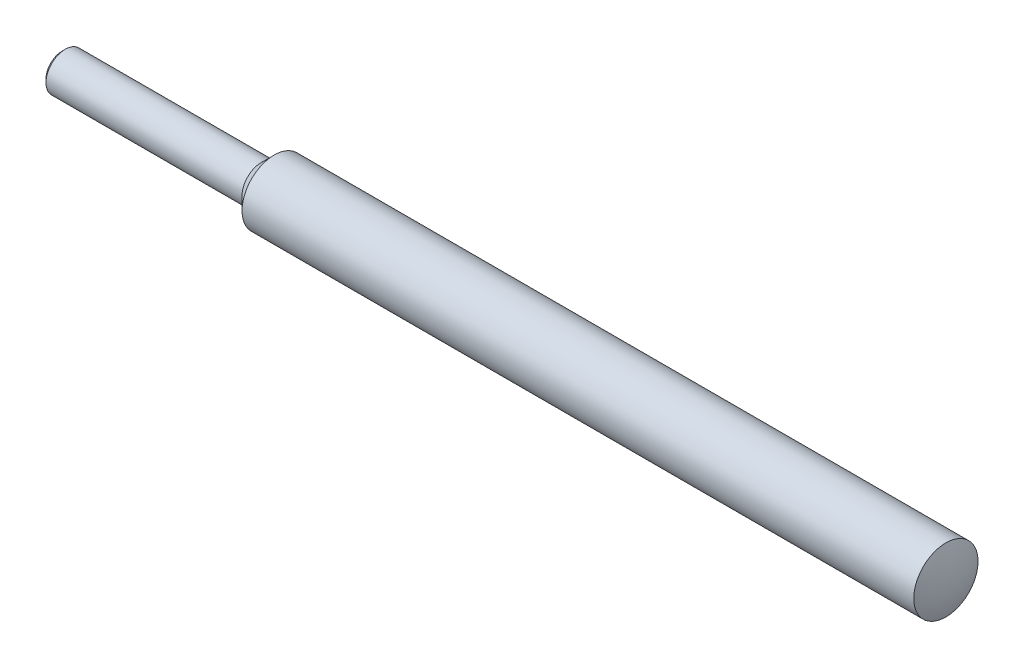
from build123d import *

# Parameters (mm, degrees)
CHAMFER1_SIZE = 1


with BuildPart() as part:
    # Sketch1 → Revolve1 (revolve)
    with BuildSketch(Plane.XY, mode=Mode.PRIVATE) as revolve1_sk:
        Polygon((0, 6), (0, 0), (275, 0), (275, 10), (66, 10), (62, 6), align=None)
        with BuildLine():
            Line((275, 10), (275, 0))
            Line((275, 0), (277, 0))
            ThreePointArc((277, 0), (276.495097568, 5.099019514), (275, 10))
        make_face()
    revolve(revolve1_sk.sketch.rotate(Axis((0, 0, 0), (1, 0, 0)), 90), axis=Axis((0, 0, 0), (1, 0, 0)))

    # Chamfer1
    chamfer1_edges = [part.edges().sort_by_distance(p)[0] for p in [
        (0, 0, -6),
    ]]
    chamfer(chamfer1_edges, length=CHAMFER1_SIZE)


solid = part.part
